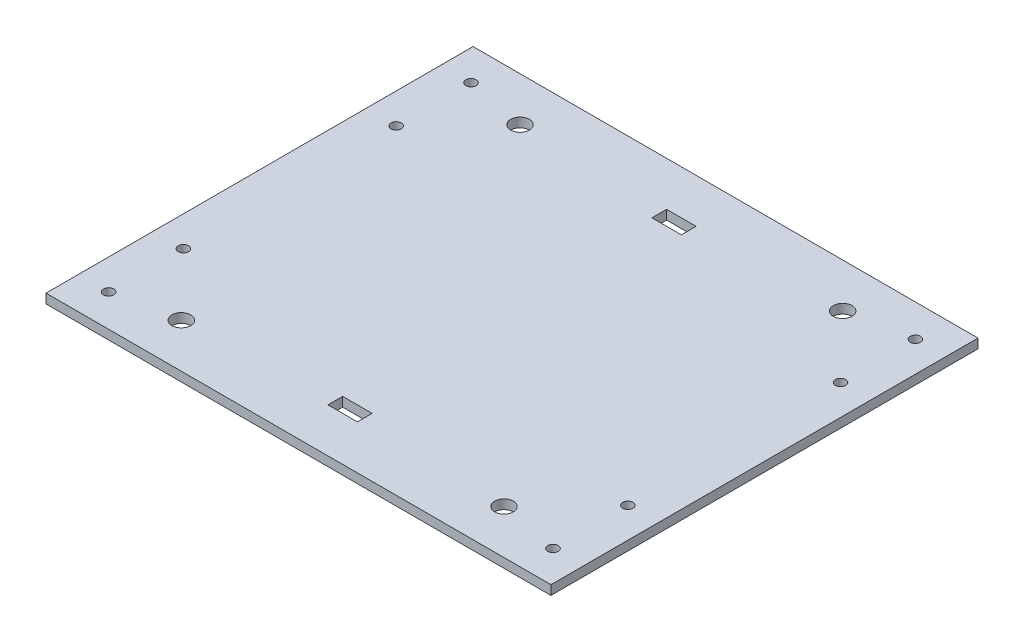
from build123d import *

# Parameters (mm, degrees)
SKETCH1_R           = 3.175
SKETCH1_R_2         = 1.75
SKETCH1_W           = 10
SKETCH1_H           = 5
BOSS_EXTRUDE2_DEPTH = 3.175


with BuildPart() as part:
    # Sketch1 → Boss-Extrude2 (new body)
    with BuildSketch(Plane(origin=(0, 0, 0), x_dir=(1, 0, 0), z_dir=(0, 1, 0))):
        Polygon((0, 0), (139.55, 0), (155.5, 0), (155.5, 145), (139.55, 145), (0, 145), (-15.95, 145), (-15.95, 0), align=None)
        with Locations(Location((15, 130, 0), (0, 0, 270))):
            Circle(SKETCH1_R, mode=Mode.SUBTRACT)
        with Locations(Location((124.55, 130, 0), (0, 0, 90))):
            Circle(SKETCH1_R, mode=Mode.SUBTRACT)
        with Locations(Location((15, 15, 0), (0, 0, 90))):
            Circle(SKETCH1_R, mode=Mode.SUBTRACT)
        with Locations(Location((124.55, 15, 0), (0, 0, 270))):
            Circle(SKETCH1_R, mode=Mode.SUBTRACT)
        with Locations(Location((-5.663, 134.0145, 0), (0, 0, 270))):
            Circle(SKETCH1_R_2, mode=Mode.SUBTRACT)
        with Locations(Location((-5.663, 108.6145, 0), (0, 0, 270))):
            Circle(SKETCH1_R_2, mode=Mode.SUBTRACT)
        with Locations(Location((145.213, 134.0145, 0), (0, 0, 90))):
            Circle(SKETCH1_R_2, mode=Mode.SUBTRACT)
        with Locations(Location((145.213, 108.6145, 0), (0, 0, 90))):
            Circle(SKETCH1_R_2, mode=Mode.SUBTRACT)
        with Locations(Location((145.213, 10.9855, 0), (0, 0, 270))):
            Circle(SKETCH1_R_2, mode=Mode.SUBTRACT)
        with Locations(Location((-5.663, 10.9855, 0), (0, 0, 90))):
            Circle(SKETCH1_R_2, mode=Mode.SUBTRACT)
        with Locations(Location((145.213, 36.3855, 0), (0, 0, 270))):
            Circle(SKETCH1_R_2, mode=Mode.SUBTRACT)
        with Locations(Location((-5.663, 36.3855, 0), (0, 0, 90))):
            Circle(SKETCH1_R_2, mode=Mode.SUBTRACT)
        with Locations((69.775, 127.5)):
            Rectangle(SKETCH1_W, SKETCH1_H, mode=Mode.SUBTRACT)
        with Locations((69.775, 17.5)):
            Rectangle(SKETCH1_W, SKETCH1_H, mode=Mode.SUBTRACT)
    extrude(amount=BOSS_EXTRUDE2_DEPTH)


solid = part.part
